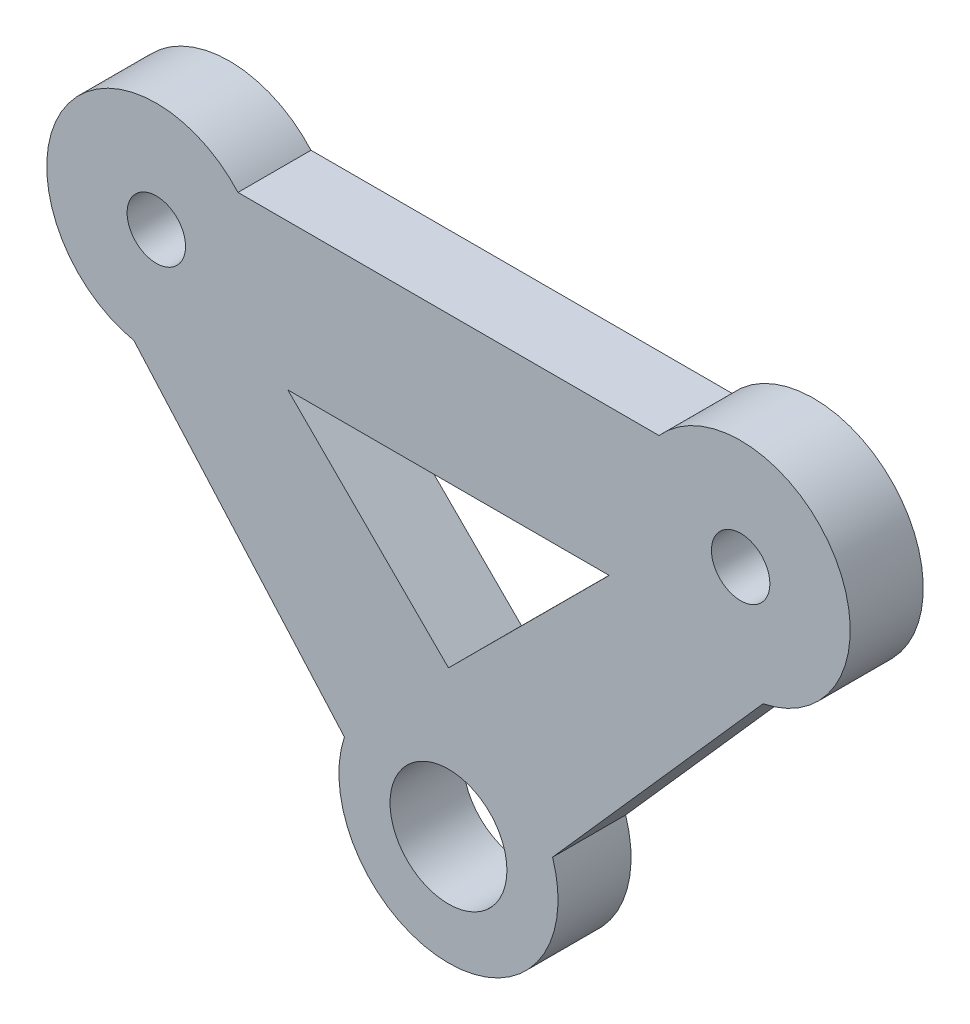
from build123d import *

# Parameters (mm, degrees)
SCHIZZO1_R                   = 4
SCHIZZO1_R_2                 = 2
ESTRUSIONE_ESTRUSIONE1_DEPTH = 5


with BuildPart() as part:
    # Schizzo1 → Estrusione-Estrusione1 (new body)
    with BuildSketch(Plane.XY):
        with BuildLine():
            Line((14.409830056, 30.980762114), (-14.409830056, 30.980762114))
            ThreePointArc((-14.409830056, 30.980762114), (-26.495190528, 29.730762114), (-21.535042047, 18.639532931))
            Line((-21.535042047, 18.639532931), (-7.125211991, 2.341229183))
            ThreePointArc((-7.125211991, 2.341229183), (0, -7.5), (7.125211991, 2.341229183))
            Line((7.125211991, 2.341229183), (21.535042047, 18.639532931))
            ThreePointArc((21.535042047, 18.639532931), (26.495190528, 29.730762114), (14.409830056, 30.980762114))
        make_face()
        Circle(SCHIZZO1_R, mode=Mode.SUBTRACT)
        with Locations((20, 25.980762114)):
            Circle(SCHIZZO1_R_2, mode=Mode.SUBTRACT)
        with Locations((-20, 25.980762114)):
            Circle(SCHIZZO1_R_2, mode=Mode.SUBTRACT)
        Polygon((11, 20.980762114), (-11, 20.980762114), (0, 10), align=None, mode=Mode.SUBTRACT)
    extrude(amount=ESTRUSIONE_ESTRUSIONE1_DEPTH)


solid = part.part
